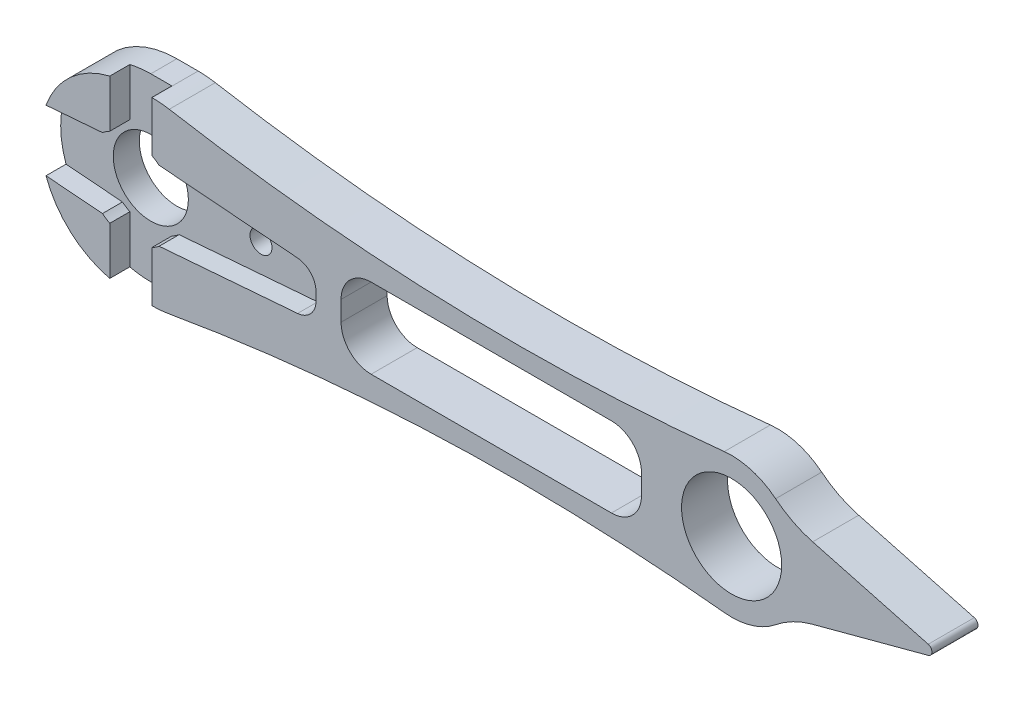
from build123d import *

# Parameters (mm, degrees)
ESQUISSE1_R             = 3.75
ESQUISSE1_R_2           = 1.6
ESQUISSE1_R_3           = 1.1
BOSS_EXTRU_1_DEPTH      = 2.6
ESQUISSE2_R             = 3.75
ESQUISSE2_R_2           = 1.6
ESQUISSE2_R_3           = 1.1
BOSS_EXTRU_2_DEPTH      = 2
ENL_V_MAT_EXTRU_1_DEPTH = 2
ENL_V_MAT_EXTRU_2_DEPTH = 41.288459886
CONG_1_R                = 2
CONG_2_R                = 10
ESQUISSE6_W             = 30
ESQUISSE6_H             = 7.96998198
ENL_V_MAT_EXTRU_4_DEPTH = 10
CONG_3_R                = 3
BOSS_EXTRU_3_DEPTH      = 4.6
CONG_4_R                = 0.5
ESQUISSE9_R             = 5
ENL_V_MAT_EXTRU_7_DEPTH = 52.019355151
CONG_5_R                = 10


with BuildPart() as part:
    # Esquisse1 → Boss.-Extru.1 (new body)
    with BuildSketch(Plane.XY):
        with BuildLine():
            Line((-30, 9), (30, 9))
            ThreePointArc((30, 9), (39, 0), (30, -9))
            Line((30, -9), (-30, -9))
            ThreePointArc((-30, -9), (-39, 0), (-30, 9))
        make_face()
        with Locations((-30, 0)):
            Circle(ESQUISSE1_R, mode=Mode.SUBTRACT)
        with Locations((30, 0)):
            Circle(ESQUISSE1_R_2, mode=Mode.SUBTRACT)
        with Locations((-19, 0)):
            Circle(ESQUISSE1_R_3, mode=Mode.SUBTRACT)
    extrude(amount=BOSS_EXTRU_1_DEPTH)

    # Esquisse2 → Boss.-Extru.2 (add)
    with BuildSketch(Plane.XY.offset(2.6)):
        with BuildLine():
            Line((-30, -9), (30, -9))
            ThreePointArc((30, -9), (39, 0), (30, 9))
            Line((30, 9), (-30, 9))
            ThreePointArc((-30, 9), (-39, 0), (-30, -9))
        make_face()
        with Locations((-30, 0)):
            Circle(ESQUISSE2_R, mode=Mode.SUBTRACT)
        with Locations((30, 0)):
            Circle(ESQUISSE2_R_2, mode=Mode.SUBTRACT)
        with Locations((-19, 0)):
            Circle(ESQUISSE2_R_3, mode=Mode.SUBTRACT)
    extrude(amount=BOSS_EXTRU_2_DEPTH)

    # Esquisse3 → Enlèv. mat.-Extru.1 (cut)
    with BuildSketch(Plane.XY.offset(4.6)):
        with BuildLine():
            Line((-32.1, 3.979949748), (-32.1, 11))
            Line((-32.1, 11), (-27.9, 11))
            Line((-27.9, 11), (-27.9, 3.979949748))
            ThreePointArc((-27.9, 3.979949748), (-27.524129159, 3.757667305), (-27.171572875, 3.5))
            Line((-27.171572875, 3.5), (-11.5, 2.25))
            Line((-11.5, 2.25), (-11.5, -2.25))
            Line((-11.5, -2.25), (-27.171572875, -3.5))
            ThreePointArc((-27.171572875, -3.5), (-27.524129159, -3.757667305), (-27.9, -3.979949748))
            Line((-27.9, -3.979949748), (-27.9, -11))
            Line((-27.9, -11), (-32.1, -11))
            Line((-32.1, -11), (-32.1, -3.979949748))
            ThreePointArc((-32.1, -3.979949748), (-32.475870841, -3.757667305), (-32.828427125, -3.5))
            Line((-32.828427125, -3.5), (-48.5, -2.25))
            Line((-48.5, -2.25), (-48.5, 2.25))
            Line((-48.5, 2.25), (-32.828427125, 3.5))
            ThreePointArc((-32.828427125, 3.5), (-32.475870841, 3.757667305), (-32.1, 3.979949748))
        make_face()
    extrude(amount=-ENL_V_MAT_EXTRU_1_DEPTH, mode=Mode.SUBTRACT)

    # Esquisse4 → Enlèv. mat.-Extru.2 (cut, through all)
    with BuildSketch(Plane.XY.offset(4.6)):
        with BuildLine():
            Line((-27, 9), (-27, 15.262477906))
            Line((-27, 15.262477906), (45.494284805, 15.262477906))
            Line((45.494284805, 15.262477906), (45.494284805, -15.262477906))
            Line((45.494284805, -15.262477906), (-27, -15.262477906))
            Line((-27, -15.262477906), (-27, -9))
            ThreePointArc((-27, -9), (1.06358338, -6), (29.270665078, -6.961901362))
            ThreePointArc((29.270665078, -6.961901362), (37, 0), (29.270665078, 6.961901362))
            ThreePointArc((29.270665078, 6.961901362), (1.06358338, 6), (-27, 9))
        make_face()
    extrude(amount=-ENL_V_MAT_EXTRU_2_DEPTH, mode=Mode.SUBTRACT)

    # Congé1
    cong_1_edges = [part.edges().sort_by_distance(p)[0] for p in [
        (-11.5, 2.25, 3.6),
        (-11.5, -2.25, 3.6),
    ]]
    fillet(cong_1_edges, radius=CONG_1_R)

    # Congé2
    cong_2_edges = [part.edges().sort_by_distance(p)[0] for p in [
        (-27, 9, 2.3),
        (-27, -9, 2.3),
    ]]
    fillet(cong_2_edges, radius=CONG_2_R)

    # Esquisse6 → Enlèv. mat.-Extru.4 (cut)
    with BuildSketch(Plane.XY.offset(4.6)):
        with Locations((6, 0)):
            Rectangle(ESQUISSE6_W, ESQUISSE6_H)
    extrude(amount=-ENL_V_MAT_EXTRU_4_DEPTH, mode=Mode.SUBTRACT)

    # Congé3
    cong_3_edges = [part.edges().sort_by_distance(p)[0] for p in [
        (-9, -3.98499099, 2.3),
        (-9, 3.98499099, 2.3),
        (21, 3.98499099, 2.3),
        (21, -3.98499099, 2.3),
    ]]
    fillet(cong_3_edges, radius=CONG_3_R)

    # Esquisse8 → Boss.-Extru.3 (add)
    with BuildSketch(Plane.XY.offset(4.6)):
        Polygon((51.444700397, 0), (35.567285724, 4.243268748), (35.567285724, -4.243268748), align=None)
    extrude(amount=-BOSS_EXTRU_3_DEPTH)

    # Congé4
    cong_4_edges = [part.edges().sort_by_distance(p)[0] for p in [
        (51.444700397, 0, 2.3),
    ]]
    fillet(cong_4_edges, radius=CONG_4_R)

    # Esquisse9 → Enlèv. mat.-Extru.7 (cut, through all)
    with BuildSketch(Plane.XY.offset(4.6)):
        with Locations((30, 0)):
            Circle(ESQUISSE9_R)
    extrude(amount=-ENL_V_MAT_EXTRU_7_DEPTH, mode=Mode.SUBTRACT)

    # Congé5
    cong_5_edges = [part.edges().sort_by_distance(p)[0] for p in [
        (35.567285724, -4.243268748, 2.3),
        (35.567285724, 4.243268748, 2.3),
    ]]
    fillet(cong_5_edges, radius=CONG_5_R)


solid = part.part
